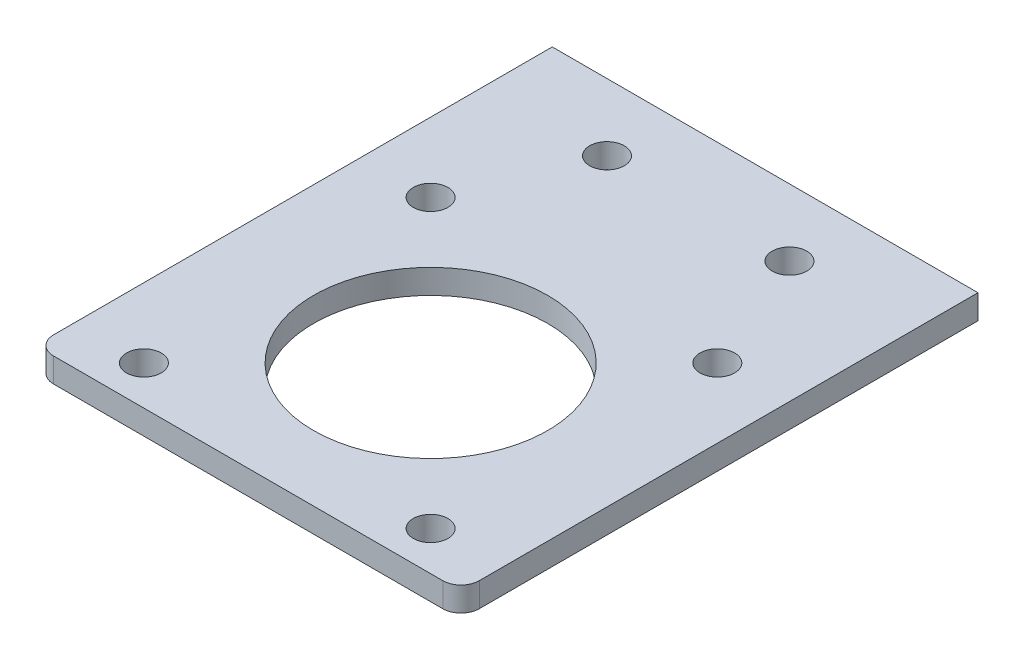
from build123d import *

# Parameters (mm, degrees)
SKETCH1_W           = 70
SKETCH1_H           = 85
BOSS_EXTRUDE1_DEPTH = 4
SKETCH2_R           = 2.85
SKETCH2_R_2         = 19.25
CUT_EXTRUDE1_DEPTH  = 56.201902141
FILLET1_R           = 3


with BuildPart() as part:
    # Sketch1 → Boss-Extrude1 (new body)
    with BuildSketch(Plane(origin=(0, 0, 0), x_dir=(1, 0, 0), z_dir=(0, 1, 0))):
        Rectangle(SKETCH1_W, SKETCH1_H)
    extrude(amount=BOSS_EXTRUDE1_DEPTH)

    # Sketch2 → Cut-Extrude1 (cut, through all)
    with BuildSketch(Plane(origin=(0, 4, 0), x_dir=(1, 0, 0), z_dir=(0, 1, 0))):
        with Locations(Location((-23.57, 11.07, 0), (0, 0, 270))):
            Circle(SKETCH2_R)
        with Locations(Location((-23.57, -36.07, 0), (0, 0, 270))):
            Circle(SKETCH2_R)
        with Locations(Location((23.57, -36.07, 0), (0, 0, 270))):
            Circle(SKETCH2_R)
        with Locations(Location((23.57, 11.07, 0), (0, 0, 270))):
            Circle(SKETCH2_R)
        with Locations(Location((0, -12.5, 0), (0, 0, 270))):
            Circle(SKETCH2_R_2)
        with Locations(Location((15, 31.5, 0), (0, 0, 270))):
            Circle(SKETCH2_R)
        with Locations(Location((-15, 31.5, 0), (0, 0, 270))):
            Circle(SKETCH2_R)
    extrude(amount=-CUT_EXTRUDE1_DEPTH, mode=Mode.SUBTRACT)

    # Fillet1
    fillet1_edges = [part.edges().sort_by_distance(p)[0] for p in [
        (35, 2, 42.5),
        (-35, 2, 42.5),
    ]]
    fillet(fillet1_edges, radius=FILLET1_R)


solid = part.part
